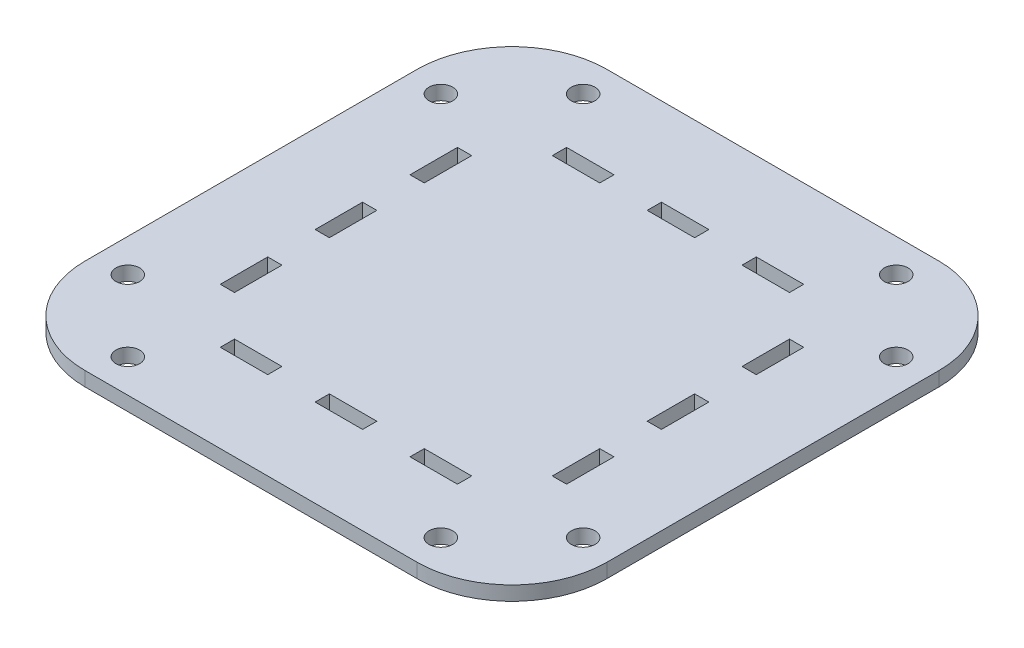
from build123d import *

# Parameters (mm, degrees)
SKETCH1_W           = 110
SKETCH1_H           = 110
SKETCH1_R           = 2.5
BOSS_EXTRUDE1_DEPTH = 3
FILLET1_R           = 20
SKETCH2_W           = 3
SKETCH2_H           = 10
SKETCH2_W_2         = 10
SKETCH2_H_2         = 3
CUT_EXTRUDE1_DEPTH  = 78.839578622


with BuildPart() as part:
    # Sketch1 → Boss-Extrude1 (new body)
    with BuildSketch(Plane(origin=(0, 0, 0), x_dir=(1, 0, 0), z_dir=(0, 1, 0))):
        Rectangle(SKETCH1_W, SKETCH1_H)
        with Locations(Location((33, 48, 0), (0, 0, 270))):
            Circle(SKETCH1_R, mode=Mode.SUBTRACT)
        with Locations(Location((-33, 48, 0), (0, 0, 270))):
            Circle(SKETCH1_R, mode=Mode.SUBTRACT)
        with Locations(Location((48, 33, 0), (0, 0, 270))):
            Circle(SKETCH1_R, mode=Mode.SUBTRACT)
        with Locations(Location((48, -33, 0), (0, 0, 270))):
            Circle(SKETCH1_R, mode=Mode.SUBTRACT)
        with Locations(Location((33, -48, 0), (0, 0, 270))):
            Circle(SKETCH1_R, mode=Mode.SUBTRACT)
        with Locations(Location((-33, -48, 0), (0, 0, 270))):
            Circle(SKETCH1_R, mode=Mode.SUBTRACT)
        with Locations(Location((-48, -33, 0), (0, 0, 270))):
            Circle(SKETCH1_R, mode=Mode.SUBTRACT)
        with Locations(Location((-48, 33, 0), (0, 0, 270))):
            Circle(SKETCH1_R, mode=Mode.SUBTRACT)
    extrude(amount=BOSS_EXTRUDE1_DEPTH)

    # Fillet1
    fillet1_edges = [part.edges().sort_by_distance(p)[0] for p in [
        (55, 1.5, 55),
        (-55, 1.5, 55),
        (-55, 1.5, -55),
        (55, 1.5, -55),
    ]]
    fillet(fillet1_edges, radius=FILLET1_R)

    # Sketch2 → Cut-Extrude1 (cut, through all)
    with BuildSketch(Plane(origin=(0, 3, 0), x_dir=(1, 0, 0), z_dir=(0, 1, 0))):
        with Locations((-35, -20)):
            Rectangle(SKETCH2_W, SKETCH2_H)
        with Locations((-35, 0)):
            Rectangle(SKETCH2_W, SKETCH2_H)
        with Locations((-20, 35)):
            Rectangle(SKETCH2_W_2, SKETCH2_H_2)
        with Locations((0, 35)):
            Rectangle(SKETCH2_W_2, SKETCH2_H_2)
        with Locations((20, 35)):
            Rectangle(SKETCH2_W_2, SKETCH2_H_2)
        with Locations((35, 20)):
            Rectangle(SKETCH2_W, SKETCH2_H)
        with Locations((35, 0)):
            Rectangle(SKETCH2_W, SKETCH2_H)
        with Locations((35, -20)):
            Rectangle(SKETCH2_W, SKETCH2_H)
        with Locations((20, -35)):
            Rectangle(SKETCH2_W_2, SKETCH2_H_2)
        with Locations((0, -35)):
            Rectangle(SKETCH2_W_2, SKETCH2_H_2)
        with Locations((-20, -35)):
            Rectangle(SKETCH2_W_2, SKETCH2_H_2)
        with Locations((-35, 20)):
            Rectangle(SKETCH2_W, SKETCH2_H)
    extrude(amount=-CUT_EXTRUDE1_DEPTH, mode=Mode.SUBTRACT)


solid = part.part
